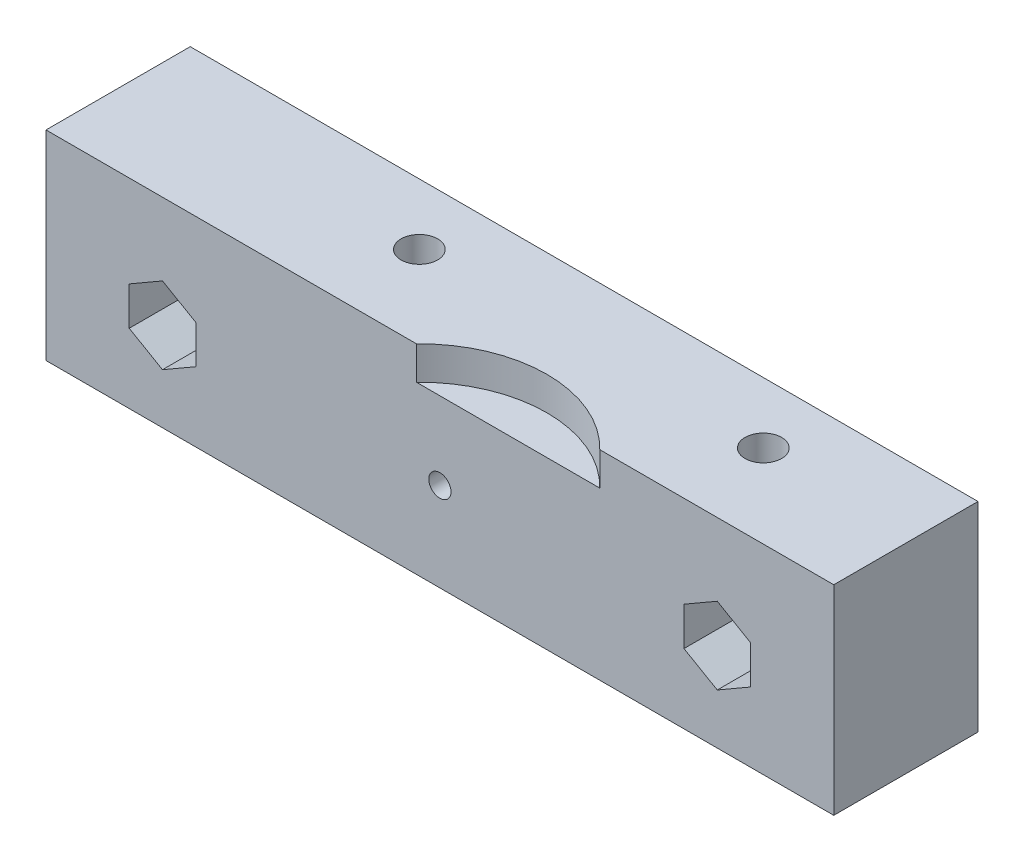
from build123d import *

# Parameters (mm, degrees)
SKETCH_1_W          = 71
SKETCH_1_H          = 18
EXTRUDE_1_DEPTH     = 13
SKETCH_2_R          = 1
SKETCH_2_R_2        = 2
CUT_EXTRUDE_1_DEPTH = 75.390859654
SKETCH_3_R          = 1.65
CUT_EXTRUDE_2_DEPTH = 75.390859654
CUT_EXTRUDE_3_DEPTH = 5
SKETCH_5_R          = 11.5
CUT_EXTRUDE_4_DEPTH = 3
SKETCH_6_R          = 3
CUT_EXTRUDE_5_DEPTH = 2


with BuildPart() as part:
    # Эскиз1 → Бобышка-Вытянуть1 (new body)
    with BuildSketch(Plane.XY):
        with Locations((35.5, 9)):
            Rectangle(SKETCH_1_W, SKETCH_1_H)
    extrude(amount=EXTRUDE_1_DEPTH)

    # Эскиз2 → Вырез-Вытянуть1 (cut, through all)
    with BuildSketch(Plane(origin=(0, 0, 0), x_dir=(-1, 0, 0), z_dir=(0, 0, -1))):
        with Locations((-35.5, 8)):
            Circle(SKETCH_2_R)
        with Locations((-10.5, 8)):
            Circle(SKETCH_2_R_2)
        with Locations((-60.5, 8)):
            Circle(SKETCH_2_R_2)
    extrude(amount=-CUT_EXTRUDE_1_DEPTH, mode=Mode.SUBTRACT)

    # Эскиз3 → Вырез-Вытянуть2 (cut, through all)
    with BuildSketch(Plane(origin=(0, 18, 0), x_dir=(1, 0, 0), z_dir=(0, 1, 0))):
        with Locations((57.15, -5.5)):
            Circle(SKETCH_3_R)
        with Locations((26.15, -5.5)):
            Circle(SKETCH_3_R)
    extrude(amount=-CUT_EXTRUDE_2_DEPTH, mode=Mode.SUBTRACT)

    # Эскиз4 → Вырез-Вытянуть3 (cut)
    with BuildSketch(Plane.XY.offset(13)):
        Polygon((60.5, 11.464101615), (57.5, 9.732050808), (57.5, 6.267949192), (60.5, 4.535898385), (63.5, 6.267949192), (63.5, 9.732050808), align=None)
        Polygon((13.5, 9.732050808), (10.5, 11.464101615), (7.5, 9.732050808), (7.5, 6.267949192), (10.5, 4.535898385), (13.5, 6.267949192), align=None)
    extrude(amount=-CUT_EXTRUDE_3_DEPTH, mode=Mode.SUBTRACT)

    # Эскиз5 → Вырез-Вытянуть4 (cut)
    with BuildSketch(Plane(origin=(0, 18, 0), x_dir=(1, 0, 0), z_dir=(0, 1, 0))):
        with Locations((41.65, -21)):
            Circle(SKETCH_5_R)
    extrude(amount=-CUT_EXTRUDE_4_DEPTH, mode=Mode.SUBTRACT)

    # Эскиз6 → Вырез-Вытянуть5 (cut)
    with BuildSketch(Plane.XZ):
        with Locations((26.15, 5.5)):
            Circle(SKETCH_6_R)
        with Locations((57.15, 5.5)):
            Circle(SKETCH_6_R)
    extrude(amount=-CUT_EXTRUDE_5_DEPTH, mode=Mode.SUBTRACT)


solid = part.part
